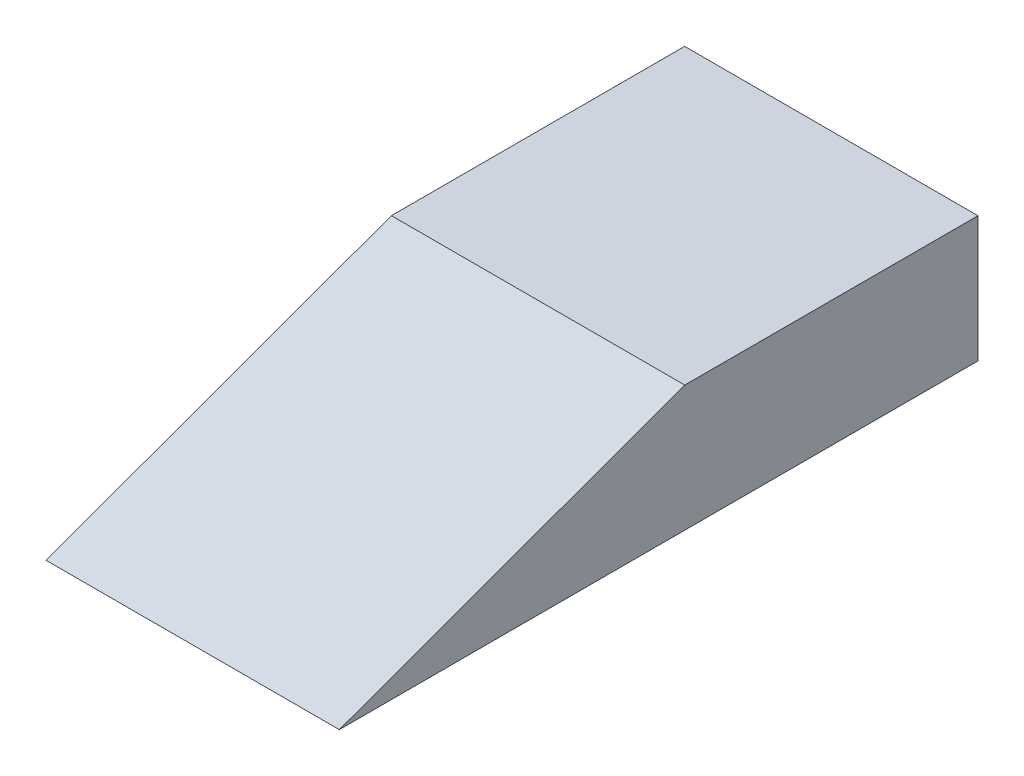
from build123d import *

# Parameters (mm, degrees)
BOSS_EXTRUDE1_DEPTH = 350


with BuildPart() as part:
    # Sketch1 → Boss-Extrude1 (new body)
    with BuildSketch(Plane(origin=(0, 0, 0), x_dir=(0, 0, -1), z_dir=(1, 0, 0))):
        Polygon((209.249211356, 61.902108757), (-202.750788644, -88.05362776), (209.249211356, -88.05362776), (559.249211356, -88.05362776), (559.249211356, 61.94637224), (209.370824275, 61.94637224), align=None)
    extrude(amount=BOSS_EXTRUDE1_DEPTH)


solid = part.part
